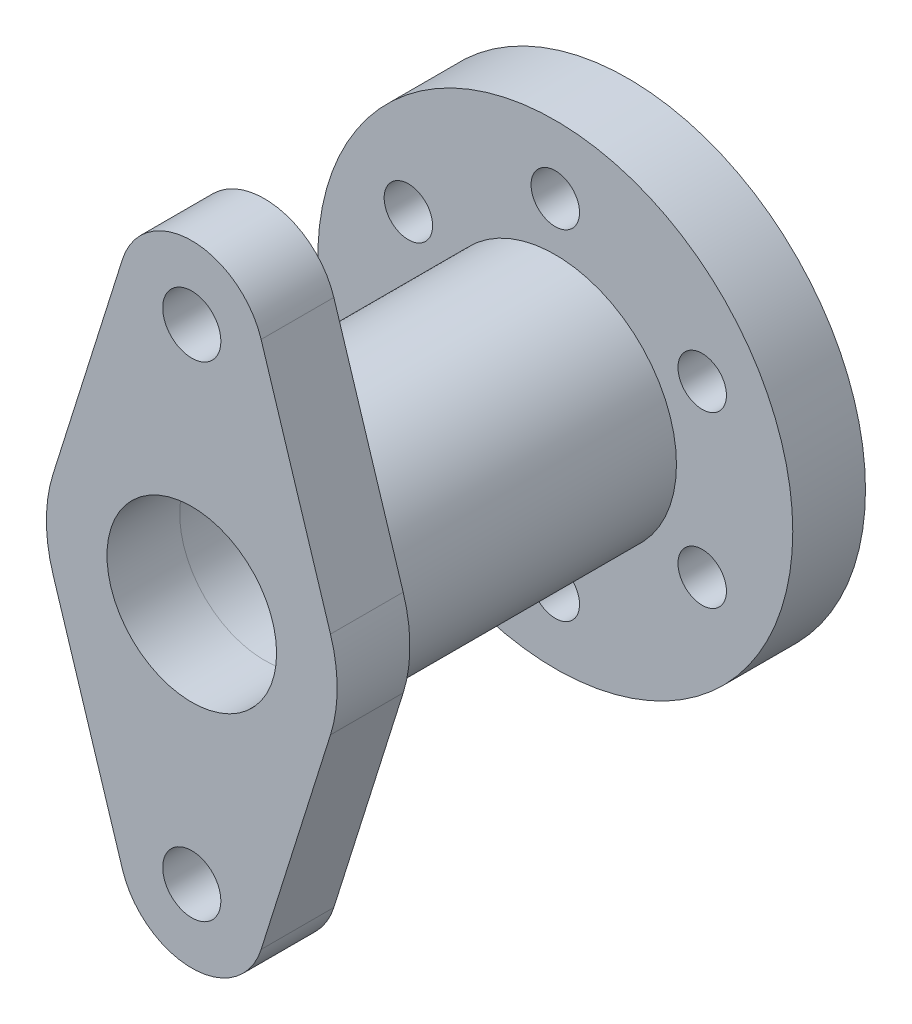
from build123d import *

# Parameters (mm, degrees)
SKETCH1_R           = 49
SKETCH1_R_2         = 5
BOSS_EXTRUDE1_DEPTH = 15
SKETCH1_3_R         = 25
BOSS_EXTRUDE2_DEPTH = 60
SKETCH2_R           = 6
BOSS_EXTRUDE3_DEPTH = 15
SKETCH3_R           = 17.5
CUT_EXTRUDE1_DEPTH  = 30
SKETCH4_R           = 14
CUT_EXTRUDE2_DEPTH  = 102.123686642


with BuildPart() as part:
    # Sketch1 → Boss-Extrude1 (new body)
    with BuildSketch(Plane.XY):
        Circle(SKETCH1_R)
        with Locations((-30.310889132, -17.5)):
            Circle(SKETCH1_R_2, mode=Mode.SUBTRACT)
        with Locations((0, -35)):
            Circle(SKETCH1_R_2, mode=Mode.SUBTRACT)
        with Locations((30.310889132, -17.5)):
            Circle(SKETCH1_R_2, mode=Mode.SUBTRACT)
        with Locations((-30.310889132, 17.5)):
            Circle(SKETCH1_R_2, mode=Mode.SUBTRACT)
        with Locations((30.310889132, 17.5)):
            Circle(SKETCH1_R_2, mode=Mode.SUBTRACT)
        with Locations((0, 35)):
            Circle(SKETCH1_R_2, mode=Mode.SUBTRACT)
    extrude(amount=-BOSS_EXTRUDE1_DEPTH)

    # Sketch1<3> → Boss-Extrude2 (add)
    with BuildSketch(Plane.XY):
        Circle(SKETCH1_3_R)
    extrude(amount=BOSS_EXTRUDE2_DEPTH)


with BuildPart() as body_2:
    # Sketch2 → Boss-Extrude3 (new body)
    with BuildSketch(Plane.XY.offset(60)):
        with BuildLine():
            Line((28.618176043, 9), (14.309088021, 54.5))
            ThreePointArc((14.309088021, 54.5), (0, 65), (-14.309088021, 54.5))
            Line((-14.309088021, 54.5), (-28.618176043, 9))
            ThreePointArc((-28.618176043, 9), (-30, 0), (-28.618176043, -9))
            Line((-28.618176043, -9), (-14.309088021, -54.5))
            ThreePointArc((-14.309088021, -54.5), (0, -65), (14.309088021, -54.5))
            Line((14.309088021, -54.5), (28.618176043, -9))
            ThreePointArc((28.618176043, -9), (30, 0), (28.618176043, 9))
        make_face()
        with Locations((0, 50)):
            Circle(SKETCH2_R, mode=Mode.SUBTRACT)
        with Locations((0, -50)):
            Circle(SKETCH2_R, mode=Mode.SUBTRACT)
    extrude(amount=BOSS_EXTRUDE3_DEPTH)


with BuildPart() as cut_extrude1_tool:
    # Sketch3 → Cut-Extrude1 (new body)
    with BuildSketch(Plane.XY.offset(75)):
        Circle(SKETCH3_R)
    extrude(amount=-CUT_EXTRUDE1_DEPTH)


with BuildPart() as part_1:
    add(part.part)

    # Cut-Extrude1: cut by cut_extrude1_tool
    add(cut_extrude1_tool.part, mode=Mode.SUBTRACT)

    # Sketch4 → Cut-Extrude2 (cut, through all)
    with BuildSketch(Plane.XY.offset(45)):
        Circle(SKETCH4_R)
    extrude(amount=-CUT_EXTRUDE2_DEPTH, mode=Mode.SUBTRACT)


with BuildPart() as body_2_1:
    add(body_2.part)

    # Cut-Extrude1: cut by cut_extrude1_tool
    add(cut_extrude1_tool.part, mode=Mode.SUBTRACT)


solid = Compound([part_1.part, body_2_1.part])
